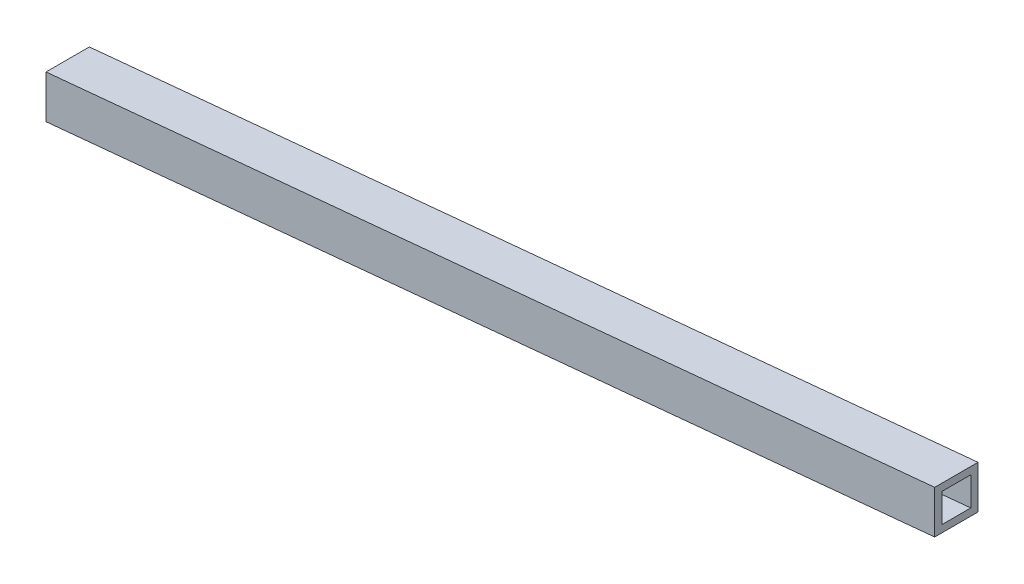
from build123d import *

# Parameters (mm, degrees)
BOSS_EXTRUDE1_DEPTH = 3.175
BOSS_EXTRUDE2_DEPTH = 12.7
BOSS_EXTRUDE3_DEPTH = 3.175


with BuildPart() as part:
    # Sketch1 → Boss-Extrude1 (new body)
    with BuildSketch(Plane(origin=(0, 0, 0), x_dir=(1, 0, 0), z_dir=(0, 1, 0))):
        Polygon((0, 19.15524942), (0, 0), (241.3, 25.4), (355.6, 37.431578947), (355.6, 56.586828367), align=None)
    extrude(amount=BOSS_EXTRUDE1_DEPTH)

    # Sketch3 → Boss-Extrude2 (add)
    with BuildSketch(Plane(origin=(0, 3.175, 0), x_dir=(1, 0, 0), z_dir=(0, 1, 0))):
        Polygon((355.6, 40.624120517), (0, 3.19254157), (0, 0), (355.6, 37.431578947), align=None)
        Polygon((0, 19.15524942), (0, 15.96270785), (355.6, 53.394286797), (355.6, 56.586828367), align=None)
    extrude(amount=BOSS_EXTRUDE2_DEPTH)

    # Sketch4 → Boss-Extrude3 (add)
    with BuildSketch(Plane(origin=(0, 15.875, 0), x_dir=(1, 0, 0), z_dir=(0, 1, 0))):
        Polygon((0, 0), (0, 19.15524942), (355.6, 56.586828367), (355.6, 37.431578947), align=None)
    extrude(amount=BOSS_EXTRUDE3_DEPTH)


solid = part.part
